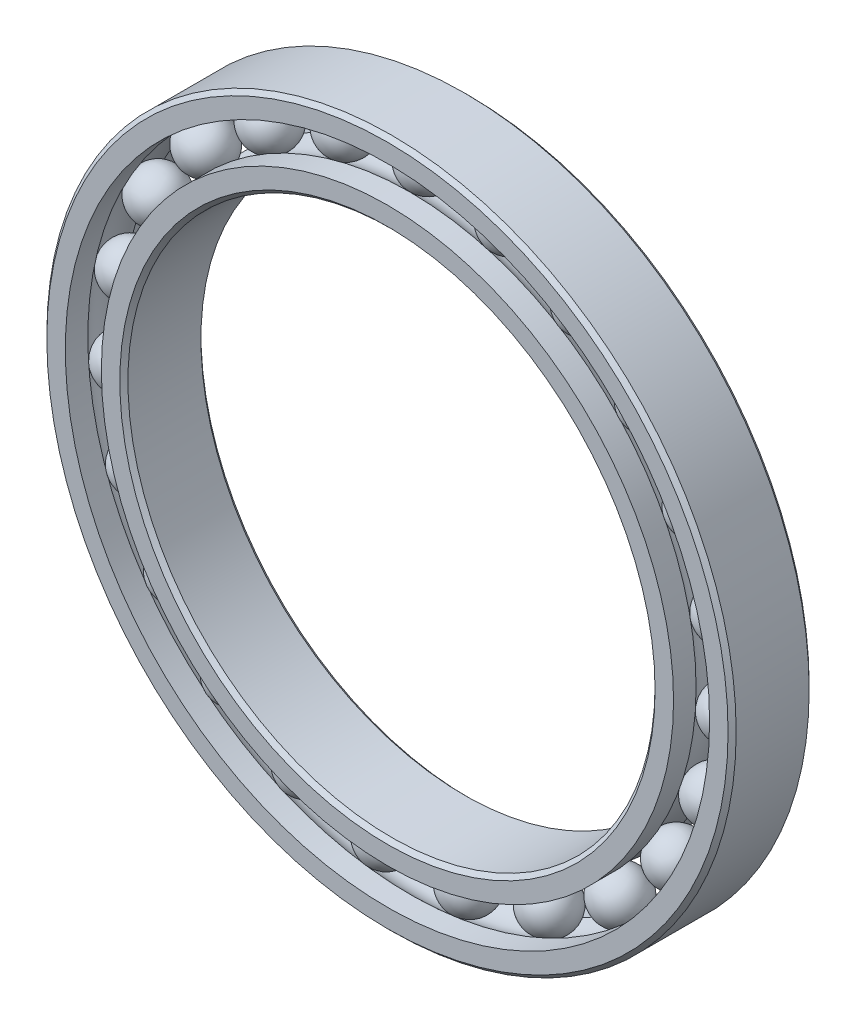
from build123d import *

# Parameters (mm, degrees)
CIRPATTERN1_COUNT = 23


with BuildPart() as part:
    # Sketch5 → Revolve1 (revolve)
    with BuildSketch(Plane(origin=(0, 0, 0), x_dir=(0, 0, -1), z_dir=(1, 0, 0))):
        with BuildLine():
            Line((4.5, 42.5), (-4.5, 42.5))
            Line((-4.5, 42.5), (-5, 42))
            Line((-5, 42), (-5, 39.722222222))
            Line((-5, 39.722222222), (-2.222222222, 39.722222222))
            ThreePointArc((-2.222222222, 39.722222222), (0, 40.642696805), (2.222222222, 39.722222222))
            Line((2.222222222, 39.722222222), (5, 39.722222222))
            Line((5, 39.722222222), (5, 42))
            Line((5, 42), (4.5, 42.5))
        make_face()
    revolve(axis=Axis((0, 0, 5), (0, 0, -1)))


with BuildPart() as body_2:
    # Sketch3 → Revolve3 (revolve)
    with BuildSketch(Plane(origin=(0, 0, 0), x_dir=(0, 0, -1), z_dir=(1, 0, 0))):
        with BuildLine():
            Line((-5, 35.277777778), (-2.222222222, 35.277777778))
            ThreePointArc((-2.222222222, 35.277777778), (0, 34.357303195), (2.222222222, 35.277777778))
            Line((2.222222222, 35.277777778), (5, 35.277777778))
            Line((5, 35.277777778), (5, 33))
            Line((5, 33), (4.5, 32.5))
            Line((4.5, 32.5), (-4.5, 32.5))
            Line((-4.5, 32.5), (-5, 33))
            Line((-5, 33), (-5, 35.277777778))
        make_face()
    revolve(axis=Axis((0, 0, 5), (0, 0, -1)))


with BuildPart() as body_3:
    # Sketch4 → Revolve4 (revolve)
    with BuildSketch(Plane(origin=(0, 0, 0), x_dir=(0, 0, -1), z_dir=(1, 0, 0))):
        with BuildLine():
            Line((-3.142696805, 37.5), (3.142696805, 37.5))
            ThreePointArc((3.142696805, 37.5), (0, 40.642696805), (-3.142696805, 37.5))
        make_face()
    revolve(axis=Axis((0, 37.5, 3.142696805), (0, 0, -1)))


with BuildPart() as cirpattern1_1:
    # CirPattern1: pattern copy
    add(body_3.part.rotate(Axis((0, 0, 0), (0, 0, 1)), 1 * 360 / CIRPATTERN1_COUNT))


with BuildPart() as cirpattern1_2:
    # CirPattern1: pattern copy
    add(body_3.part.rotate(Axis((0, 0, 0), (0, 0, 1)), 2 * 360 / CIRPATTERN1_COUNT))


with BuildPart() as cirpattern1_3:
    # CirPattern1: pattern copy
    add(body_3.part.rotate(Axis((0, 0, 0), (0, 0, 1)), 3 * 360 / CIRPATTERN1_COUNT))


with BuildPart() as cirpattern1_4:
    # CirPattern1: pattern copy
    add(body_3.part.rotate(Axis((0, 0, 0), (0, 0, 1)), 4 * 360 / CIRPATTERN1_COUNT))


with BuildPart() as cirpattern1_5:
    # CirPattern1: pattern copy
    add(body_3.part.rotate(Axis((0, 0, 0), (0, 0, 1)), 5 * 360 / CIRPATTERN1_COUNT))


with BuildPart() as cirpattern1_6:
    # CirPattern1: pattern copy
    add(body_3.part.rotate(Axis((0, 0, 0), (0, 0, 1)), 6 * 360 / CIRPATTERN1_COUNT))


with BuildPart() as cirpattern1_7:
    # CirPattern1: pattern copy
    add(body_3.part.rotate(Axis((0, 0, 0), (0, 0, 1)), 7 * 360 / CIRPATTERN1_COUNT))


with BuildPart() as cirpattern1_8:
    # CirPattern1: pattern copy
    add(body_3.part.rotate(Axis((0, 0, 0), (0, 0, 1)), 8 * 360 / CIRPATTERN1_COUNT))


with BuildPart() as cirpattern1_9:
    # CirPattern1: pattern copy
    add(body_3.part.rotate(Axis((0, 0, 0), (0, 0, 1)), 9 * 360 / CIRPATTERN1_COUNT))


with BuildPart() as cirpattern1_10:
    # CirPattern1: pattern copy
    add(body_3.part.rotate(Axis((0, 0, 0), (0, 0, 1)), 10 * 360 / CIRPATTERN1_COUNT))


with BuildPart() as cirpattern1_11:
    # CirPattern1: pattern copy
    add(body_3.part.rotate(Axis((0, 0, 0), (0, 0, 1)), 11 * 360 / CIRPATTERN1_COUNT))


with BuildPart() as cirpattern1_12:
    # CirPattern1: pattern copy
    add(body_3.part.rotate(Axis((0, 0, 0), (0, 0, 1)), 12 * 360 / CIRPATTERN1_COUNT))


with BuildPart() as cirpattern1_13:
    # CirPattern1: pattern copy
    add(body_3.part.rotate(Axis((0, 0, 0), (0, 0, 1)), 13 * 360 / CIRPATTERN1_COUNT))


with BuildPart() as cirpattern1_14:
    # CirPattern1: pattern copy
    add(body_3.part.rotate(Axis((0, 0, 0), (0, 0, 1)), 14 * 360 / CIRPATTERN1_COUNT))


with BuildPart() as cirpattern1_15:
    # CirPattern1: pattern copy
    add(body_3.part.rotate(Axis((0, 0, 0), (0, 0, 1)), 15 * 360 / CIRPATTERN1_COUNT))


with BuildPart() as cirpattern1_16:
    # CirPattern1: pattern copy
    add(body_3.part.rotate(Axis((0, 0, 0), (0, 0, 1)), 16 * 360 / CIRPATTERN1_COUNT))


with BuildPart() as cirpattern1_17:
    # CirPattern1: pattern copy
    add(body_3.part.rotate(Axis((0, 0, 0), (0, 0, 1)), 17 * 360 / CIRPATTERN1_COUNT))


with BuildPart() as cirpattern1_18:
    # CirPattern1: pattern copy
    add(body_3.part.rotate(Axis((0, 0, 0), (0, 0, 1)), 18 * 360 / CIRPATTERN1_COUNT))


with BuildPart() as cirpattern1_19:
    # CirPattern1: pattern copy
    add(body_3.part.rotate(Axis((0, 0, 0), (0, 0, 1)), 19 * 360 / CIRPATTERN1_COUNT))


with BuildPart() as cirpattern1_20:
    # CirPattern1: pattern copy
    add(body_3.part.rotate(Axis((0, 0, 0), (0, 0, 1)), 20 * 360 / CIRPATTERN1_COUNT))


with BuildPart() as cirpattern1_21:
    # CirPattern1: pattern copy
    add(body_3.part.rotate(Axis((0, 0, 0), (0, 0, 1)), 21 * 360 / CIRPATTERN1_COUNT))


with BuildPart() as cirpattern1_22:
    # CirPattern1: pattern copy
    add(body_3.part.rotate(Axis((0, 0, 0), (0, 0, 1)), 22 * 360 / CIRPATTERN1_COUNT))


solid = Compound([part.part, body_2.part, body_3.part, cirpattern1_1.part, cirpattern1_2.part, cirpattern1_3.part, cirpattern1_4.part, cirpattern1_5.part, cirpattern1_6.part, cirpattern1_7.part, cirpattern1_8.part, cirpattern1_9.part, cirpattern1_10.part, cirpattern1_11.part, cirpattern1_12.part, cirpattern1_13.part, cirpattern1_14.part, cirpattern1_15.part, cirpattern1_16.part, cirpattern1_17.part, cirpattern1_18.part, cirpattern1_19.part, cirpattern1_20.part, cirpattern1_21.part, cirpattern1_22.part])
